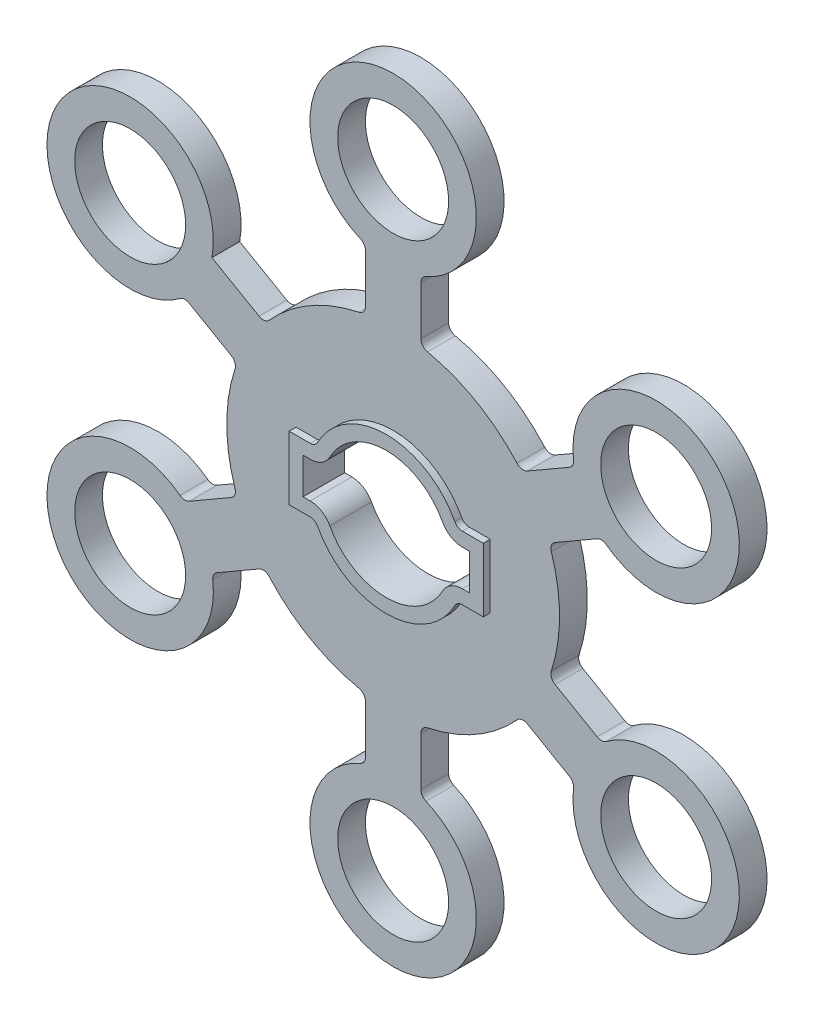
from build123d import *

# Parameters (mm, degrees)
BOSS_EXTRUDE1_DEPTH = 7.5
SKETCH1_3_R         = 20
BOSS_EXTRUDE2_DEPTH = 5


with BuildPart() as part:
    # Sketch1 → Boss-Extrude1 (new, symmetric)
    with BuildSketch(Plane.XY):
        with BuildLine():
            ThreePointArc((-24.748222274, 13.096774194), (-25.852186654, 11.930011924), (-27.399817518, 11.5))
            Line((-27.399817518, 11.5), (-35, 11.5))
            Line((-35, 11.5), (-35, -11.5))
            Line((-35, -11.5), (-27.399817518, -11.5))
            ThreePointArc((-27.399817518, -11.5), (-25.852186654, -11.930011924), (-24.748222274, -13.096774194))
            ThreePointArc((-24.748222274, -13.096774194), (0, -28), (24.748222274, -13.096774194))
            ThreePointArc((24.748222274, -13.096774194), (25.852186654, -11.930011924), (27.399817518, -11.5))
            Line((27.399817518, -11.5), (35, -11.5))
            Line((35, -11.5), (35, 11.5))
            Line((35, 11.5), (27.399817518, 11.5))
            ThreePointArc((27.399817518, 11.5), (25.852186654, 11.930011924), (24.748222274, 13.096774194))
            ThreePointArc((24.748222274, 13.096774194), (0, 28), (-24.748222274, 13.096774194))
        make_face()
        with BuildLine():
            Line((-30, 6.5), (-27.399817518, 6.5))
            ThreePointArc((-27.399817518, 6.5), (-23.272801881, 7.646698465), (-20.328896868, 10.758064516))
            ThreePointArc((-20.328896868, 10.758064516), (0, 23), (20.328896868, 10.758064516))
            ThreePointArc((20.328896868, 10.758064516), (23.272801881, 7.646698465), (27.399817518, 6.5))
            Line((27.399817518, 6.5), (30, 6.5))
            Line((30, 6.5), (30, -6.5))
            Line((30, -6.5), (27.399817518, -6.5))
            ThreePointArc((27.399817518, -6.5), (23.272801881, -7.646698465), (20.328896868, -10.758064516))
            ThreePointArc((20.328896868, -10.758064516), (0, -23), (-20.328896868, -10.758064516))
            ThreePointArc((-20.328896868, -10.758064516), (-23.272801881, -7.646698465), (-27.399817518, -6.5))
            Line((-27.399817518, -6.5), (-30, -6.5))
            Line((-30, -6.5), (-30, 6.5))
        make_face(mode=Mode.SUBTRACT)
    extrude(amount=BOSS_EXTRUDE1_DEPTH, both=True)

    # Sketch1<3> → Boss-Extrude2 (add, symmetric)
    with BuildSketch(Plane.XY):
        with BuildLine():
            Line((63.561930641, 48.24450315), (48.38539126, 39.482324053))
            ThreePointArc((48.38539126, 39.482324053), (46.413721828, 39.117710954), (44.652753581, 40.07657168))
            ThreePointArc((44.652753581, 40.07657168), (30, 51.961524227), (12.380952381, 58.70870479))
            ThreePointArc((12.380952381, 58.70870479), (10.67007051, 59.754317665), (10, 61.64414003))
            Line((10, 61.64414003), (10, 79.168498224))
            ThreePointArc((10, 79.168498224), (10.49545867, 80.819943871), (11.818181818, 81.925907476))
            ThreePointArc((11.818181818, 81.925907476), (0, 139.5), (-11.818181818, 81.925907476))
            ThreePointArc((-11.818181818, 81.925907476), (-10.49545867, 80.819943871), (-10, 79.168498224))
            Line((-10, 79.168498224), (-10, 61.64414003))
            ThreePointArc((-10, 61.64414003), (-10.67007051, 59.754317665), (-12.380952381, 58.70870479))
            ThreePointArc((-12.380952381, 58.70870479), (-30, 51.961524227), (-44.652753581, 40.07657168))
            ThreePointArc((-44.652753581, 40.07657168), (-46.413721828, 39.117710954), (-48.38539126, 39.482324053))
            Line((-48.38539126, 39.482324053), (-65.334884287, 49.268118414))
            ThreePointArc((-65.334884287, 49.268118414), (-120.308802103, 70.587282596), (-76.859008012, 30.728108057))
            ThreePointArc((-76.859008012, 30.728108057), (-75.23985386, 31.320638103), (-73.561930641, 30.923995074))
            Line((-73.561930641, 30.923995074), (-58.38539126, 22.161815977))
            ThreePointArc((-58.38539126, 22.161815977), (-57.083792338, 20.636606711), (-57.033705962, 18.63213311))
            ThreePointArc((-57.033705962, 18.63213311), (-60, 0), (-57.033705962, -18.63213311))
            ThreePointArc((-57.033705962, -18.63213311), (-57.083792338, -20.636606711), (-58.38539126, -22.161815977))
            Line((-58.38539126, -22.161815977), (-73.561930641, -30.923995074))
            ThreePointArc((-73.561930641, -30.923995074), (-75.23985386, -31.320638103), (-76.859008012, -30.728108057))
            ThreePointArc((-76.859008012, -30.728108057), (-120.810543828, -69.75), (-65.040826193, -51.197799419))
            ThreePointArc((-65.040826193, -51.197799419), (-64.74439519, -49.499305768), (-63.561930641, -48.24450315))
            Line((-63.561930641, -48.24450315), (-48.38539126, -39.482324053))
            ThreePointArc((-48.38539126, -39.482324053), (-46.413721828, -39.117710954), (-44.652753581, -40.07657168))
            ThreePointArc((-44.652753581, -40.07657168), (-30, -51.961524227), (-12.380952381, -58.70870479))
            ThreePointArc((-12.380952381, -58.70870479), (-10.67007051, -59.754317665), (-10, -61.64414003))
            Line((-10, -61.64414003), (-10, -79.168498224))
            ThreePointArc((-10, -79.168498224), (-10.49545867, -80.819943871), (-11.818181818, -81.925907476))
            ThreePointArc((-11.818181818, -81.925907476), (0, -139.5), (11.818181818, -81.925907476))
            ThreePointArc((11.818181818, -81.925907476), (10.49545867, -80.819943871), (10, -79.168498224))
            Line((10, -79.168498224), (10, -61.64414003))
            ThreePointArc((10, -61.64414003), (10.67007051, -59.754317665), (12.380952381, -58.70870479))
            ThreePointArc((12.380952381, -58.70870479), (30, -51.961524227), (44.652753581, -40.07657168))
            ThreePointArc((44.652753581, -40.07657168), (46.413721828, -39.117710954), (48.38539126, -39.482324053))
            Line((48.38539126, -39.482324053), (63.561930641, -48.24450315))
            ThreePointArc((63.561930641, -48.24450315), (64.74439519, -49.499305768), (65.040826193, -51.197799419))
            ThreePointArc((65.040826193, -51.197799419), (120.810543828, -69.75), (76.859008012, -30.728108057))
            ThreePointArc((76.859008012, -30.728108057), (75.23985386, -31.320638103), (73.561930641, -30.923995074))
            Line((73.561930641, -30.923995074), (58.38539126, -22.161815977))
            ThreePointArc((58.38539126, -22.161815977), (57.083792338, -20.636606711), (57.033705962, -18.63213311))
            ThreePointArc((57.033705962, -18.63213311), (60, 0), (57.033705962, 18.63213311))
            ThreePointArc((57.033705962, 18.63213311), (57.083792338, 20.636606711), (58.38539126, 22.161815977))
            Line((58.38539126, 22.161815977), (73.561930641, 30.923995074))
            ThreePointArc((73.561930641, 30.923995074), (75.23985386, 31.320638103), (76.859008012, 30.728108057))
            ThreePointArc((76.859008012, 30.728108057), (120.810543828, 69.75), (65.040826193, 51.197799419))
            ThreePointArc((65.040826193, 51.197799419), (64.74439519, 49.499305768), (63.561930641, 48.24450315))
        make_face()
        with Locations((0, -109.5)):
            Circle(SKETCH1_3_R, mode=Mode.SUBTRACT)
        with Locations((-94.829781714, -54.75)):
            Circle(SKETCH1_3_R, mode=Mode.SUBTRACT)
        with BuildLine():
            Line((-35, 11.5), (-27.399817518, 11.5))
            ThreePointArc((-27.399817518, 11.5), (-25.852186654, 11.930011924), (-24.748222274, 13.096774194))
            ThreePointArc((-24.748222274, 13.096774194), (0, 28), (24.748222274, 13.096774194))
            ThreePointArc((24.748222274, 13.096774194), (25.852186654, 11.930011924), (27.399817518, 11.5))
            Line((27.399817518, 11.5), (35, 11.5))
            Line((35, 11.5), (35, -11.5))
            Line((35, -11.5), (27.399817518, -11.5))
            ThreePointArc((27.399817518, -11.5), (25.852186654, -11.930011924), (24.748222274, -13.096774194))
            ThreePointArc((24.748222274, -13.096774194), (0, -28), (-24.748222274, -13.096774194))
            ThreePointArc((-24.748222274, -13.096774194), (-25.852186654, -11.930011924), (-27.399817518, -11.5))
            Line((-27.399817518, -11.5), (-35, -11.5))
            Line((-35, -11.5), (-35, 11.5))
        make_face(mode=Mode.SUBTRACT)
        with Locations((94.829781714, -54.75)):
            Circle(SKETCH1_3_R, mode=Mode.SUBTRACT)
        with Locations((-94.829781714, 54.75)):
            Circle(SKETCH1_3_R, mode=Mode.SUBTRACT)
        with Locations((0, 109.5)):
            Circle(SKETCH1_3_R, mode=Mode.SUBTRACT)
        with Locations((94.829781714, 54.75)):
            Circle(SKETCH1_3_R, mode=Mode.SUBTRACT)
    extrude(amount=BOSS_EXTRUDE2_DEPTH, both=True)


solid = part.part
